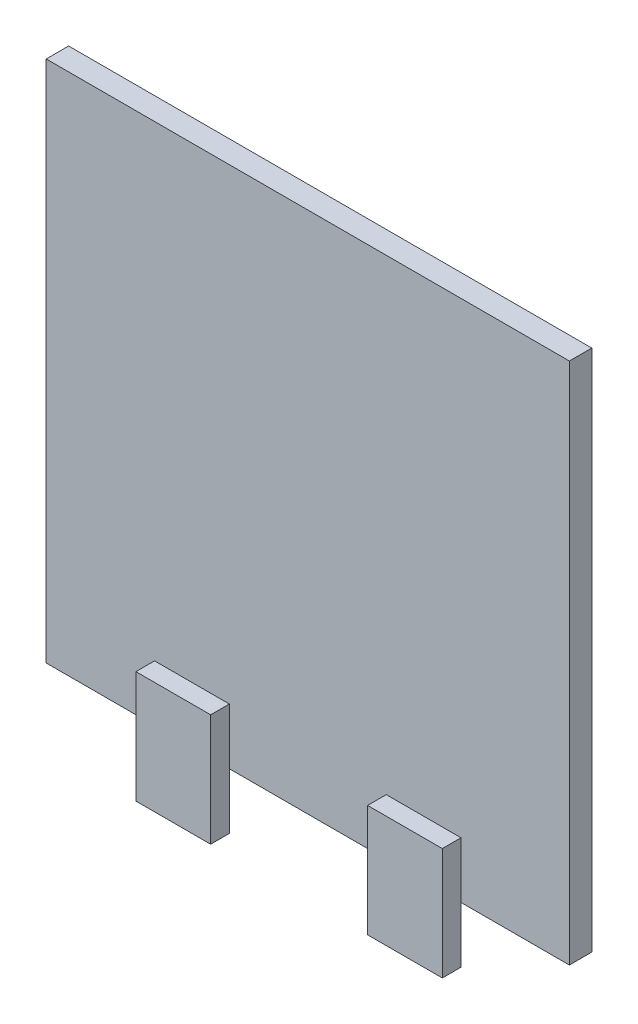
from build123d import *

# Parameters (mm, degrees)
SKETCH1_W           = 140
SKETCH1_H           = 140
BOSS_EXTRUDE1_DEPTH = 6
SKETCH2_W           = 20
SKETCH2_H           = 30
BOSS_EXTRUDE2_DEPTH = 5


with BuildPart() as part:
    # Sketch1 → Boss-Extrude1 (new body)
    with BuildSketch(Plane.XY):
        Rectangle(SKETCH1_W, SKETCH1_H)
    extrude(amount=BOSS_EXTRUDE1_DEPTH)

    # Sketch2 → Boss-Extrude2 (add)
    with BuildSketch(Plane.XY.offset(6)):
        with Locations((-31, -70)):
            Rectangle(SKETCH2_W, SKETCH2_H)
        with Locations((31, -70)):
            Rectangle(SKETCH2_W, SKETCH2_H)
    extrude(amount=BOSS_EXTRUDE2_DEPTH)


solid = part.part
